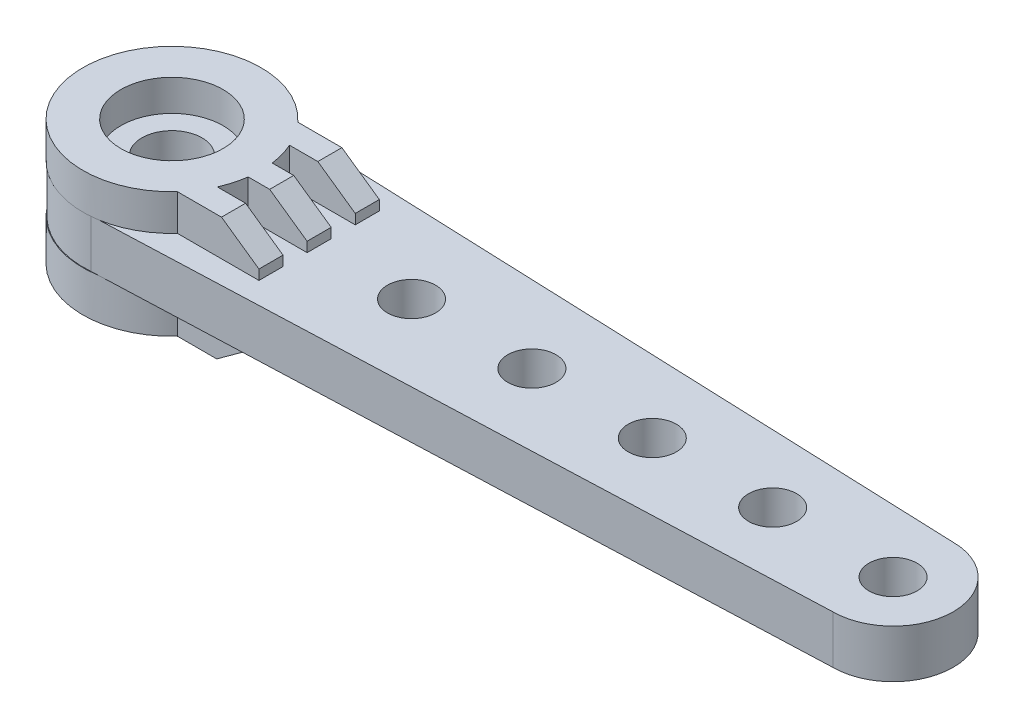
from build123d import *

# Parameters (mm, degrees)
SKETCH1_R               = 1
BOSS_EXTRUDE1_DEPTH     = 2
SKETCH3_R               = 3.7
BOSS_EXTRUDE2_DEPTH     = 1.7
BOSS_EXTRUDE3_START     = 1.5
SKETCH4_R               = 3.7
BOSS_EXTRUDE3_DEPTH     = 1.5
SKETCH5_R               = 1.25
CUT_EXTRUDE2_DEPTH      = 34.071626812
SKETCH6_R               = 2.25
CUT_EXTRUDE3_DEPTH      = 2.6
SKETCH7_R               = 2.125
CUT_EXTRUDE4_DEPTH      = 1.3
CORTAR_EXTRUIR1_START   = -2
CROQUIS3_R              = 1
CORTAR_EXTRUIR1_DEPTH   = 2
SALIENTE_EXTRUIR3_DEPTH = 1.5
CORTAR_EXTRUIR2_DEPTH   = 5
CORTAR_EXTRUIR3_DEPTH   = 5
SALIENTE_EXTRUIR4_START = -1.7
SALIENTE_EXTRUIR4_DEPTH = 1.7
CORTAR_EXTRUIR4_DEPTH   = 50
CORTAR_EXTRUIR5_DEPTH   = 50


with BuildPart() as part:
    # Sketch1 → Boss-Extrude1 (new body)
    with BuildSketch(Plane(origin=(0, 0, 0), x_dir=(1, 0, 0), z_dir=(0, 1, 0))):
        with BuildLine():
            Line((0.565718668, 3.631196413), (29.95, 2.5))
            ThreePointArc((29.95, 2.5), (32.45, 0), (29.95, -2.5))
            Line((29.95, -2.5), (0.307337184, -3.662126275))
            ThreePointArc((0.307337184, -3.662126275), (-3.672695956, 0.130113074), (0.565718668, 3.631196413))
        make_face()
        with Locations(Location((29.95, 0, 0), (0, 0, 270))):
            Circle(SKETCH1_R, mode=Mode.SUBTRACT)
    extrude(amount=BOSS_EXTRUDE1_DEPTH)

    # Sketch3 → Boss-Extrude2 (add)
    with BuildSketch(Plane.XZ):
        with Locations(Location((0, 0, 0), (0, 0, 80.620746463))):
            Circle(SKETCH3_R)
    extrude(amount=BOSS_EXTRUDE2_DEPTH)

    # Sketch4 → Boss-Extrude3 (add)
    with BuildSketch(Plane(origin=(0, 2, 0), x_dir=(1, 0, 0), z_dir=(0, 1, 0)).offset(BOSS_EXTRUDE3_START)):
        with Locations(Location((0, 0, 0), (0, 0, 279.379253537))):
            Circle(SKETCH4_R)
    extrude(amount=-BOSS_EXTRUDE3_DEPTH)

    # Sketch5 → Cut-Extrude2 (cut, through all)
    with BuildSketch(Plane(origin=(0, 3.5, 0), x_dir=(1, 0, 0), z_dir=(0, 1, 0))):
        with Locations(Location((0, 0, 0), (0, 0, 270))):
            Circle(SKETCH5_R)
    extrude(amount=-CUT_EXTRUDE2_DEPTH, mode=Mode.SUBTRACT)

    # Sketch6 → Cut-Extrude3 (cut)
    with BuildSketch(Plane.XZ.offset(1.7)):
        with Locations(Location((0, 0, 0), (0, 0, 270))):
            Circle(SKETCH6_R)
    extrude(amount=-CUT_EXTRUDE3_DEPTH, mode=Mode.SUBTRACT)

    # Sketch7 → Cut-Extrude4 (cut)
    with BuildSketch(Plane(origin=(0, 3.5, 0), x_dir=(1, 0, 0), z_dir=(0, 1, 0))):
        with Locations(Location((0, 0, 0), (0, 0, 270))):
            Circle(SKETCH7_R)
    extrude(amount=-CUT_EXTRUDE4_DEPTH, mode=Mode.SUBTRACT)

    # Croquis3 → Cortar-Extruir1 (cut)
    with BuildSketch(Plane(origin=(0, 2, 0), x_dir=(1, 0, 0), z_dir=(0, 1, 0)).offset(CORTAR_EXTRUIR1_START)):
        with Locations(Location((29.95, 0, 0), (0, 0, 270))):
            Circle(CROQUIS3_R)
        with Locations(Location((24.95, 0, 0), (0, 0, 270))):
            Circle(CROQUIS3_R)
        with Locations(Location((19.95, 0, 0), (0, 0, 270))):
            Circle(CROQUIS3_R)
        with Locations(Location((14.95, 0, 0), (0, 0, 270))):
            Circle(CROQUIS3_R)
        with Locations(Location((9.95, 0, 0), (0, 0, 270))):
            Circle(CROQUIS3_R)
    extrude(amount=CORTAR_EXTRUIR1_DEPTH, mode=Mode.SUBTRACT)

    # Croquis5 → Saliente-Extruir3 (add)
    with BuildSketch(Plane(origin=(0, 3.5, 0), x_dir=(1, 0, 0), z_dir=(0, 1, 0))):
        with BuildLine():
            Line((6.7, -0.5), (6.7, 0.5))
            Line((6.7, 0.5), (3.666060556, 0.5))
            ThreePointArc((3.666060556, 0.5), (3.7, 0), (3.666060556, -0.5))
            Line((3.666060556, -0.5), (6.7, -0.5))
        make_face()
        with BuildLine():
            Line((6.112876483, -2.5), (6.112876483, -1.5))
            Line((6.112876483, -1.5), (3.382306905, -1.5))
            ThreePointArc((3.382306905, -1.5), (3.095618131, -2.026610073), (2.727636339, -2.5))
            Line((2.727636339, -2.5), (6.112876483, -2.5))
        make_face()
        with BuildLine():
            Line((6.112876483, 2.5), (6.112876483, 1.5))
            Line((6.112876483, 1.5), (3.382306905, 1.5))
            ThreePointArc((3.382306905, 1.5), (3.095618131, 2.026610073), (2.727636339, 2.5))
            Line((2.727636339, 2.5), (6.112876483, 2.5))
        make_face()
    extrude(amount=-SALIENTE_EXTRUIR3_DEPTH)

    # Croquis7 → Cortar-Extruir2 (cut, symmetric)
    with BuildSketch(Plane.XY.offset(0.5)):
        Polygon((6.7, 2), (4.55777799, 3.5), (6.7, 3.5), align=None)
    extrude(amount=CORTAR_EXTRUIR2_DEPTH, both=True, mode=Mode.SUBTRACT)

    # Croquis8 → Cortar-Extruir3 (cut, symmetric)
    with BuildSketch(Plane.XY.offset(0.5)):
        Polygon((6.112876483, 2.411108312), (6.112876483, 2), (6.7, 2), align=None)
    extrude(amount=CORTAR_EXTRUIR3_DEPTH, both=True, mode=Mode.SUBTRACT)

    # Croquis10 → Saliente-Extruir4 (add)
    with BuildSketch(Plane.XZ.offset(1.7).offset(SALIENTE_EXTRUIR4_START)):
        with BuildLine():
            Line((3.666060556, -0.5), (6.7, -0.5))
            Line((6.7, -0.5), (6.7, 0.5))
            Line((6.7, 0.5), (3.666060556, 0.5))
            ThreePointArc((3.666060556, 0.5), (3.691505388, 0.250575281), (3.7, 0))
            ThreePointArc((3.7, 0), (3.691505388, -0.250575281), (3.666060556, -0.5))
        make_face()
        with BuildLine():
            Line((6.112876483, -1.5), (3.382306905, -1.5))
            ThreePointArc((3.382306905, -1.5), (3.095618131, -2.026610073), (2.727636339, -2.5))
            Line((2.727636339, -2.5), (6.112876483, -2.5))
            Line((6.112876483, -2.5), (6.112876483, -1.5))
        make_face()
        with BuildLine():
            Line((6.112876483, 2.5), (2.727636339, 2.5))
            ThreePointArc((2.727636339, 2.5), (3.095618131, 2.026610073), (3.382306905, 1.5))
            Line((3.382306905, 1.5), (6.112876483, 1.5))
            Line((6.112876483, 1.5), (6.112876483, 2.5))
        make_face()
    extrude(amount=SALIENTE_EXTRUIR4_DEPTH)

    # Croquis11 → Cortar-Extruir4 (cut, symmetric)
    with BuildSketch(Plane.XY.offset(0.5)):
        Polygon((6.7, 0), (4.360150735, -1.7), (6.7, -1.7), align=None)
    extrude(amount=CORTAR_EXTRUIR4_DEPTH, both=True, mode=Mode.SUBTRACT)

    # Croquis12 → Cortar-Extruir5 (cut, symmetric)
    with BuildSketch(Plane.XY.offset(0.5)):
        Polygon((6.112876483, 0), (6.112876483, -0.426570204), (6.7, 0), align=None)
    extrude(amount=CORTAR_EXTRUIR5_DEPTH, both=True, mode=Mode.SUBTRACT)


solid = part.part
